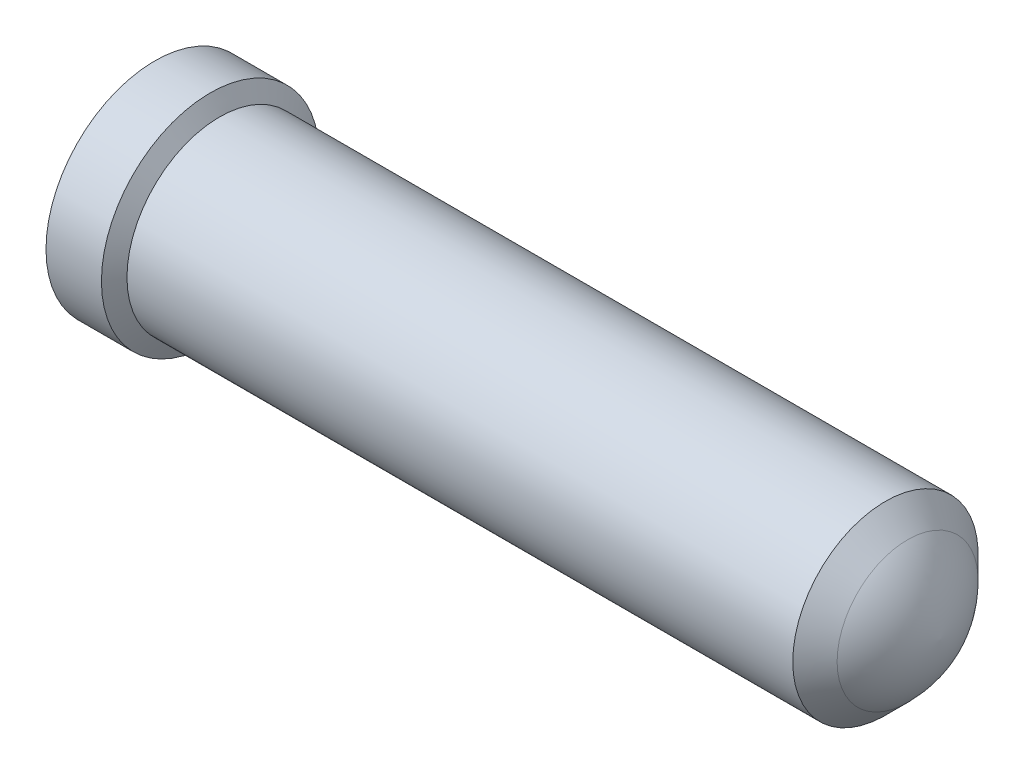
from build123d import *

# Parameters (mm, degrees)
HOLE2_D           = 0.9144
HOLE2_DEPTH       = 1.9304
HOLE2_CSINK_D     = 1.0922
HOLE2_CSINK_ANGLE = 90
HOLE2_TIP         = 0.274713475


with BuildPart() as part:
    # Sketch1 → RevolutionAngle1 (revolve)
    with BuildSketch(Plane.XY, mode=Mode.PRIVATE) as revolutionangle1_sk:
        with BuildLine():
            Line((0, 0), (0, 0.62357))
            Line((0, 0.62357), (0.3175, 0.62357))
            Line((0.3175, 0.62357), (0.371026143, 0.53086))
            Line((0.371026143, 0.53086), (4.184420176, 0.53086))
            Line((4.184420176, 0.53086), (4.311420176, 0.40386))
            ThreePointArc((4.311420176, 0.40386), (4.440054413, 0.218568435), (4.4958, 0))
            Line((4.4958, 0), (0, 0))
        make_face()
    revolve(revolutionangle1_sk.sketch.rotate(Axis((0, 0, 0), (1, 0, 0)), 90), axis=Axis((0, 0, 0), (1, 0, 0)))

    # Hole2
    with Locations(Plane(origin=(0, 0, 0), x_dir=(0, 0, -1), z_dir=(-1, 0, 0))):
        with Locations((0, 0)):
            CounterSinkHole(HOLE2_D / 2, HOLE2_CSINK_D / 2, depth=HOLE2_DEPTH, counter_sink_angle=HOLE2_CSINK_ANGLE)
            with Locations((0, 0, -(HOLE2_DEPTH + HOLE2_TIP / 2))):  # 118° drill point
                Cone(0, HOLE2_D / 2, HOLE2_TIP, mode=Mode.SUBTRACT)


solid = part.part
